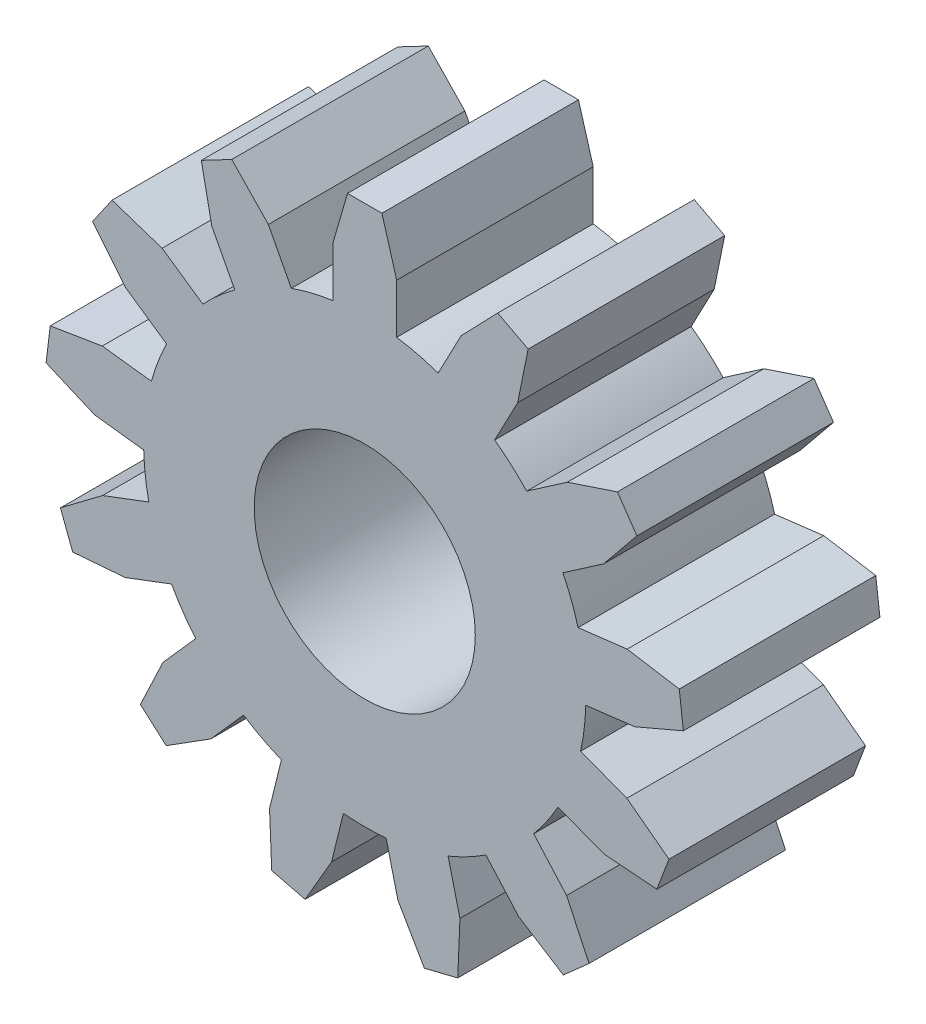
from build123d import *

# Parameters (mm, degrees)
SZKIC1_R                    = 2.25
DODANIE_WYCI_GNI_CIE1_DEPTH = 4


with BuildPart() as part:
    # Szkic1 → Dodanie-wyciągnięcie1 (new body)
    with BuildSketch(Plane.XY):
        with BuildLine():
            Line((-0.65, 5.460113222), (-0.65, 4.452808103))
            ThreePointArc((-0.65, 4.452808103), (-1.076920489, 4.369238178), (-1.493776689, 4.244835827))
            Line((-1.493776689, 4.244835827), (-1.96189472, 5.136760215))
            Line((-1.96189472, 5.136760215), (-2.706408708, 5.9097675))
            Line((-2.706408708, 5.9097675), (-3.326227926, 5.58446128))
            Line((-3.326227926, 5.58446128), (-3.112987553, 4.532620091))
            Line((-3.112987553, 4.532620091), (-2.644869523, 3.640695704))
            ThreePointArc((-2.644869523, 3.640695704), (-2.984051962, 3.368298367), (-3.295347141, 3.06442282))
            Line((-3.295347141, 3.06442282), (-4.124343002, 3.636637347))
            Line((-4.124343002, 3.636637347), (-5.142811797, 3.975108403))
            Line((-5.142811797, 3.975108403), (-5.54045712, 3.399019697))
            Line((-5.54045712, 3.399019697), (-4.862827173, 2.566758322))
            Line((-4.862827173, 2.566758322), (-4.033831312, 1.994543794))
            ThreePointArc((-4.033831312, 1.994543794), (-4.207573092, 1.595721992), (-4.341993276, 1.181987475))
            Line((-4.341993276, 1.181987475), (-5.341954007, 1.30340469))
            Line((-5.341954007, 1.30340469), (-6.401058681, 1.129799877))
            Line((-6.401058681, 1.129799877), (-6.485434357, 0.434903665))
            Line((-6.485434357, 0.434903665), (-5.498651691, 0.012883153))
            Line((-5.498651691, 0.012883153), (-4.49869096, -0.108534062))
            ThreePointArc((-4.49869096, -0.108534062), (-4.467189933, -0.542415061), (-4.393941078, -0.971226957))
            Line((-4.393941078, -0.971226957), (-5.335787726, -1.328422275))
            Line((-5.335787726, -1.328422275), (-6.192900162, -1.974332186))
            Line((-6.192900162, -1.974332186), (-5.944676741, -2.628843556))
            Line((-5.944676741, -2.628843556), (-4.874801373, -2.54394339))
            Line((-4.874801373, -2.54394339), (-3.932954725, -2.186748072))
            ThreePointArc((-3.932954725, -2.186748072), (-3.703427397, -2.55629136), (-3.439289932, -2.901944997))
            Line((-3.439289932, -2.901944997), (-4.10725678, -3.655923705))
            Line((-4.10725678, -3.655923705), (-4.566022849, -4.626168538))
            Line((-4.566022849, -4.626168538), (-4.042065325, -5.090354399))
            Line((-4.042065325, -5.090354399), (-3.134192808, -4.517983161))
            Line((-3.134192808, -4.517983161), (-2.466225959, -3.764004452))
            ThreePointArc((-2.466225959, -3.764004452), (-2.091254274, -3.984552115), (-1.69673891, -4.16786241))
            Line((-1.69673891, -4.16786241), (-1.937802804, -5.145897073))
            Line((-1.937802804, -5.145897073), (-1.893124727, -6.21820543))
            Line((-1.893124727, -6.21820543), (-1.213465455, -6.385726395))
            Line((-1.213465455, -6.385726395), (-0.675578441, -5.457007437))
            Line((-0.675578441, -5.457007437), (-0.434514548, -4.478972774))
            ThreePointArc((-0.434514548, -4.478972774), (0, -4.5), (0.434514548, -4.478972774))
            Line((0.434514548, -4.478972774), (0.675578441, -5.457007437))
            Line((0.675578441, -5.457007437), (1.213465455, -6.385726395))
            Line((1.213465455, -6.385726395), (1.893124727, -6.21820543))
            Line((1.893124727, -6.21820543), (1.937802804, -5.145897073))
            Line((1.937802804, -5.145897073), (1.69673891, -4.16786241))
            ThreePointArc((1.69673891, -4.16786241), (2.091254274, -3.984552115), (2.466225959, -3.764004452))
            Line((2.466225959, -3.764004452), (3.134192808, -4.517983161))
            Line((3.134192808, -4.517983161), (4.042065325, -5.090354399))
            Line((4.042065325, -5.090354399), (4.566022849, -4.626168538))
            Line((4.566022849, -4.626168538), (4.10725678, -3.655923705))
            Line((4.10725678, -3.655923705), (3.439289932, -2.901944997))
            ThreePointArc((3.439289932, -2.901944997), (3.703427397, -2.55629136), (3.932954725, -2.186748072))
            Line((3.932954725, -2.186748072), (4.874801373, -2.54394339))
            Line((4.874801373, -2.54394339), (5.944676741, -2.628843556))
            Line((5.944676741, -2.628843556), (6.192900162, -1.974332186))
            Line((6.192900162, -1.974332186), (5.335787726, -1.328422275))
            Line((5.335787726, -1.328422275), (4.393941078, -0.971226957))
            ThreePointArc((4.393941078, -0.971226957), (4.467189933, -0.542415061), (4.49869096, -0.108534062))
            Line((4.49869096, -0.108534062), (5.498651691, 0.012883153))
            Line((5.498651691, 0.012883153), (6.485434357, 0.434903665))
            Line((6.485434357, 0.434903665), (6.401058681, 1.129799877))
            Line((6.401058681, 1.129799877), (5.341954007, 1.30340469))
            Line((5.341954007, 1.30340469), (4.341993276, 1.181987475))
            ThreePointArc((4.341993276, 1.181987475), (4.207573092, 1.595721992), (4.033831312, 1.994543794))
            Line((4.033831312, 1.994543794), (4.862827173, 2.566758322))
            Line((4.862827173, 2.566758322), (5.54045712, 3.399019697))
            Line((5.54045712, 3.399019697), (5.142811797, 3.975108403))
            Line((5.142811797, 3.975108403), (4.124343002, 3.636637347))
            Line((4.124343002, 3.636637347), (3.295347141, 3.06442282))
            ThreePointArc((3.295347141, 3.06442282), (2.984051962, 3.368298367), (2.644869523, 3.640695704))
            Line((2.644869523, 3.640695704), (3.112987553, 4.532620091))
            Line((3.112987553, 4.532620091), (3.326227926, 5.58446128))
            Line((3.326227926, 5.58446128), (2.706408708, 5.9097675))
            Line((2.706408708, 5.9097675), (1.96189472, 5.136760215))
            Line((1.96189472, 5.136760215), (1.493776689, 4.244835827))
            ThreePointArc((1.493776689, 4.244835827), (1.076920489, 4.369238178), (0.65, 4.452808103))
            Line((0.65, 4.452808103), (0.65, 5.460113222))
            Line((0.65, 5.460113222), (0.35, 6.490570083))
            Line((0.35, 6.490570083), (-0.35, 6.490570083))
            Line((-0.35, 6.490570083), (-0.65, 5.460113222))
        make_face()
        Circle(SZKIC1_R, mode=Mode.SUBTRACT)
    extrude(amount=DODANIE_WYCI_GNI_CIE1_DEPTH)


solid = part.part
